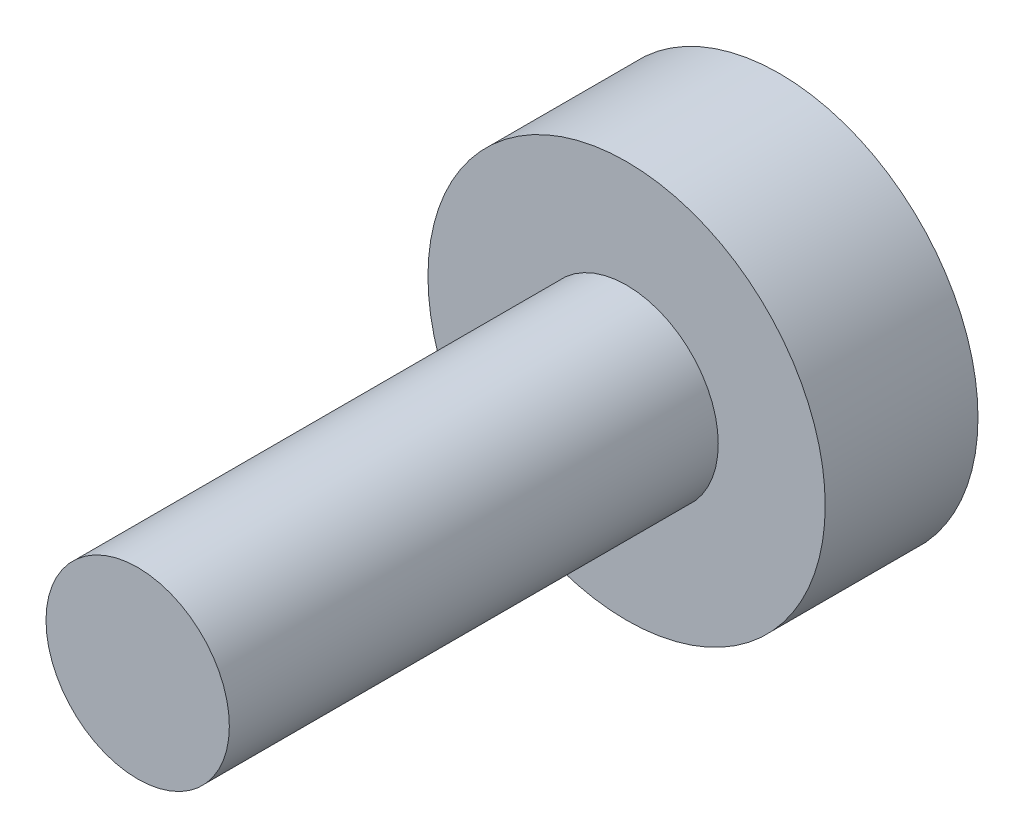
from build123d import *

# Parameters (mm, degrees)
SKETCH_1_R      = 6.5
EXTRUDE_1_DEPTH = 5
SKETCH_2_R      = 3
EXTRUDE_2_DEPTH = 21


with BuildPart() as part:
    # 草图1 → 凸台-拉伸1 (new body)
    with BuildSketch(Plane.XY):
        Circle(SKETCH_1_R)
    extrude(amount=EXTRUDE_1_DEPTH)

    # 草图2 → 凸台-拉伸2 (add)
    with BuildSketch(Plane.XY):
        with Locations(Location((0, 0, 0), (0, 0, 180))):
            Circle(SKETCH_2_R)
    extrude(amount=EXTRUDE_2_DEPTH)


solid = part.part
